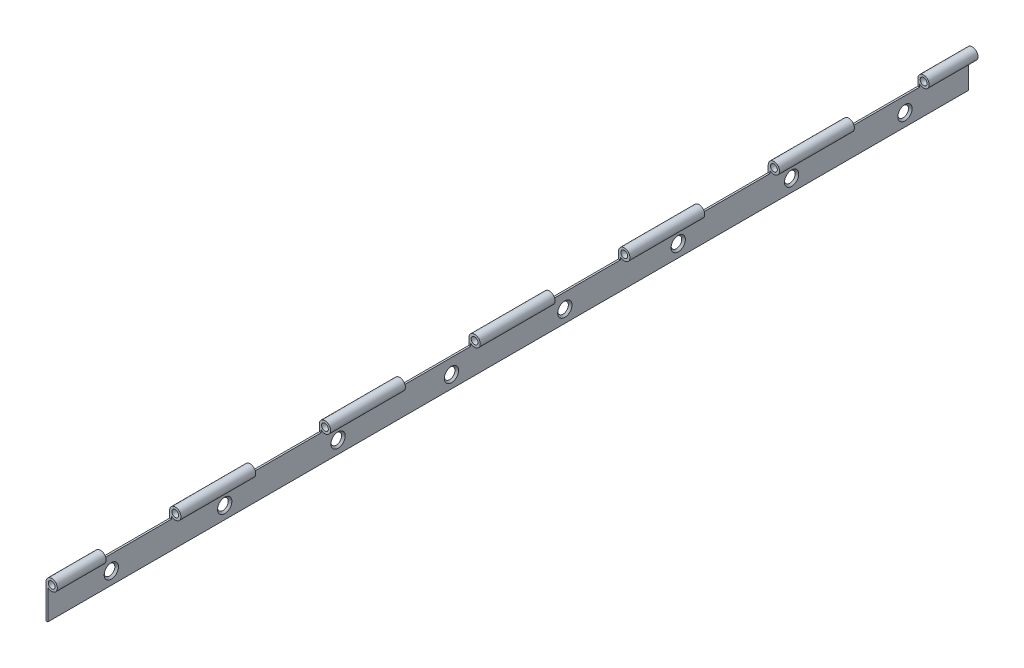
from build123d import *

# Parameters (mm, degrees)
SKETCH_1_W             = 0.8
SKETCH_1_H             = 15
EXTRUDE_1_DEPTH        = 203
SKETCH_2_R             = 2.5
SKETCH_3_R             = 1.5
CUT_EXTRUDE_1_DEPTH    = 407.407738607
SKETCH_10_W            = 33
SKETCH_10_H            = 6
CUT_EXTRUDE_4_DEPTH    = 60
PATTERN_LINEAR_1_COUNT = 8
PATTERN_LINEAR_1_PITCH = 50


with BuildPart() as part:
    # 草图1 → 拉伸-薄壁1 (new, symmetric)
    with BuildSketch(Plane.XY):
        with Locations((0.4, 7.5)):
            Rectangle(SKETCH_1_W, SKETCH_1_H)
    extrude(amount=EXTRUDE_1_DEPTH, both=True)

    # 扫描1: sweep along a curve in space
    with BuildLine() as sweep_1_path:
        Line((0.8, 15, 203), (0.8, 15, -203))
    # 草图2 → 扫描1 (sweep)
    with BuildSketch(Plane.XY.offset(203)):
        with Locations((2.5, 15)):
            Circle(SKETCH_2_R)
    sweep(path=sweep_1_path.line)

    # 草图3 → 切除-拉伸1 (cut, through all)
    with BuildSketch(Plane.XY.offset(203)):
        with Locations((2.5, 15)):
            Circle(SKETCH_3_R)
    extrude(amount=-CUT_EXTRUDE_1_DEPTH, mode=Mode.SUBTRACT)

    # 草图10 → 切除-拉伸4 (cut, symmetric)
    with BuildSketch(Plane(origin=(0.8, 0, 0), x_dir=(0, 0, -1), z_dir=(1, 0, 0))):
        with Locations((-165, 15)):
            Rectangle(SKETCH_10_W, SKETCH_10_H)
        with Locations((-99, 15)):
            Rectangle(SKETCH_10_W, SKETCH_10_H)
        with Locations((-33, 15)):
            Rectangle(SKETCH_10_W, SKETCH_10_H)
        with Locations((33, 15)):
            Rectangle(SKETCH_10_W, SKETCH_10_H)
        with Locations((99, 15)):
            Rectangle(SKETCH_10_W, SKETCH_10_H)
        with Locations((165, 15)):
            Rectangle(SKETCH_10_W, SKETCH_10_H)
    extrude(amount=CUT_EXTRUDE_4_DEPTH, both=True, mode=Mode.SUBTRACT)

    # 草图12 → M3 锥坑平头螺钉的锥形沉头孔2 (revolve, cut)
    with BuildSketch(Plane(origin=(0.8, 5.5, -175), x_dir=(0, 0, -1), z_dir=(0, 1, 0))):
        Polygon((0, 0), (0, 0.8), (1.7, 0.8), (1.7, 1.45), (3.15, 0), align=None)
    hole_wizard_m3_2 = revolve(axis=Axis((7.15, 5.5, -175), (-1, 0, 0)), mode=Mode.SUBTRACT)

    # 阵列(线性)1: M3 锥坑平头螺钉的锥形沉头孔2 ×8
    with Locations(*[(0, 0, i * PATTERN_LINEAR_1_PITCH) for i in range(1, PATTERN_LINEAR_1_COUNT)]):
        add(hole_wizard_m3_2, mode=Mode.SUBTRACT)


solid = part.part
